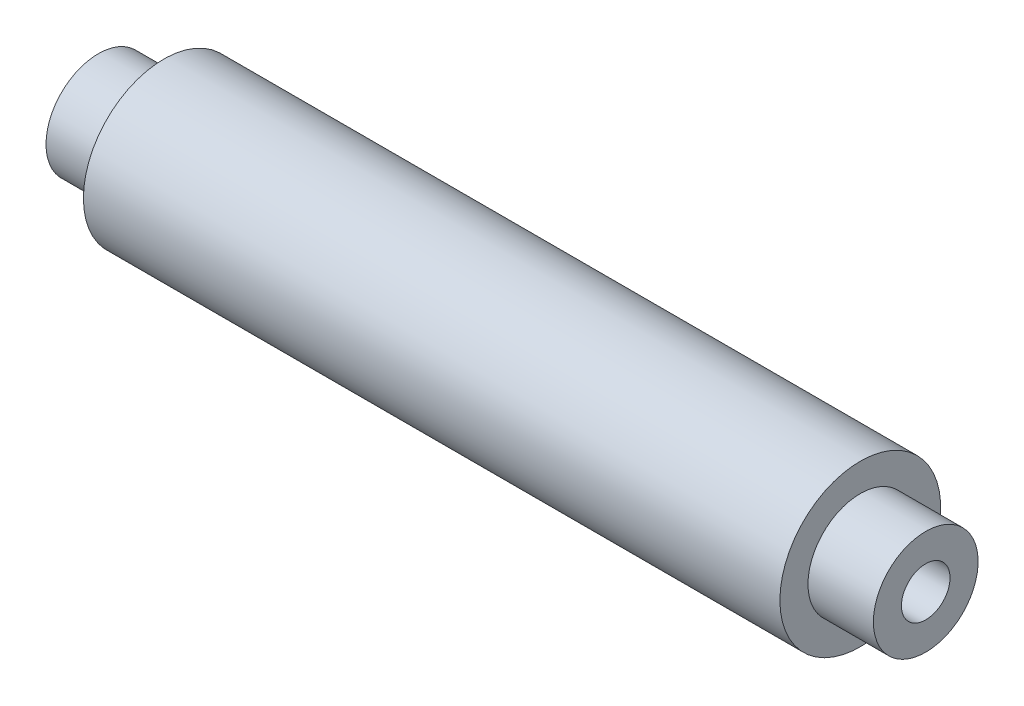
from build123d import *


with BuildPart() as part:
    # Sketch1 → Revolve1 (revolve)
    with BuildSketch(Plane.XY, mode=Mode.PRIVATE) as revolve1_sk:
        Polygon((0, 1.3), (12.5, 1.3), (12.5, 0), (31.75, 0), (31.75, 1.3), (44.25, 1.3), (44.25, 2.8), (40.75, 2.8), (40.75, 4.3), (3.5, 4.3), (3.5, 2.8), (0, 2.8), align=None)
    revolve(revolve1_sk.sketch.rotate(Axis((0, 0, 0), (1, 0, 0)), 90), axis=Axis((0, 0, 0), (1, 0, 0)))


solid = part.part
